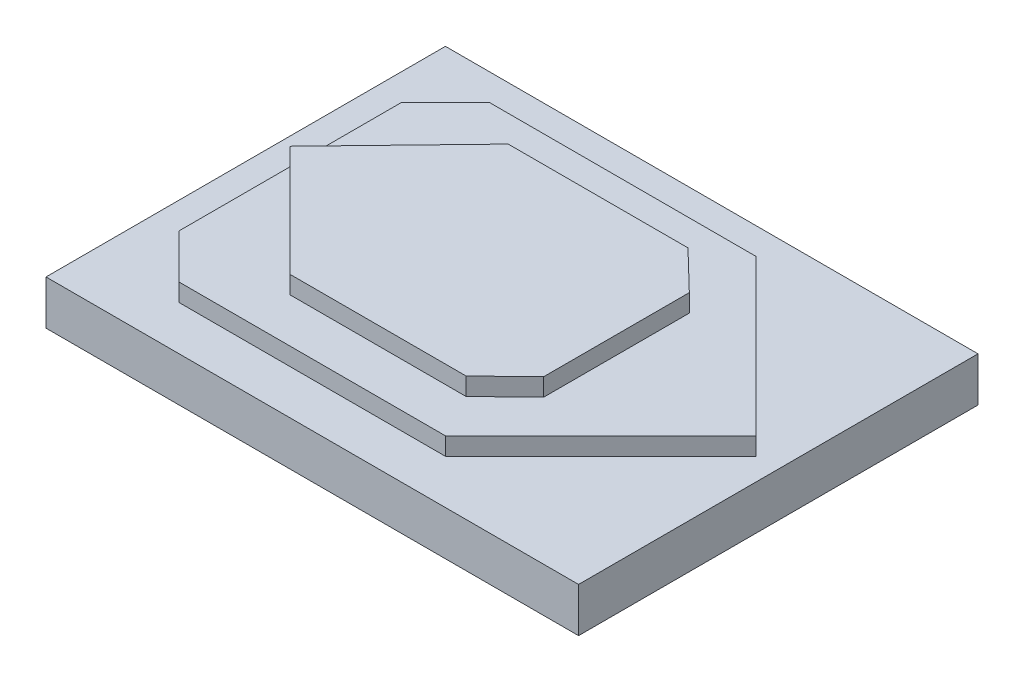
from build123d import *

# Parameters (mm, degrees)
SKETCH1_W           = 120
SKETCH1_H           = 90
BOSS_EXTRUDE1_DEPTH = 10
BOSS_EXTRUDE2_DEPTH = 4
BOSS_EXTRUDE3_DEPTH = 4


with BuildPart() as part:
    # Sketch1 → Boss-Extrude1 (new body)
    with BuildSketch(Plane(origin=(0, 0, 0), x_dir=(1, 0, 0), z_dir=(0, 1, 0))):
        with Locations((60, 45)):
            Rectangle(SKETCH1_W, SKETCH1_H)
    extrude(amount=BOSS_EXTRUDE1_DEPTH)

    # Sketch2 → Boss-Extrude2 (add)
    with BuildSketch(Plane(origin=(0, 10, 0), x_dir=(1, 0, 0), z_dir=(0, 1, 0))):
        Polygon((10, 70), (20, 80), (80, 80), (115, 45), (80, 10), (20, 10), (10, 20), align=None)
    extrude(amount=BOSS_EXTRUDE2_DEPTH)

    # Sketch3 → Boss-Extrude3 (add)
    with BuildSketch(Plane(origin=(0, 18, 0), x_dir=(-1, 0, 0), z_dir=(0, -1, 0))):
        Polygon((-10, 45), (-34.14221937, 70), (-74.652034735, 70), (-83.534243972, 61.422550244), (-83.534243972, 43.169206873), (-83.534243972, 28.58424312), (-74.645, 20), (-35, 20), align=None)
    extrude(amount=BOSS_EXTRUDE3_DEPTH)


solid = part.part
